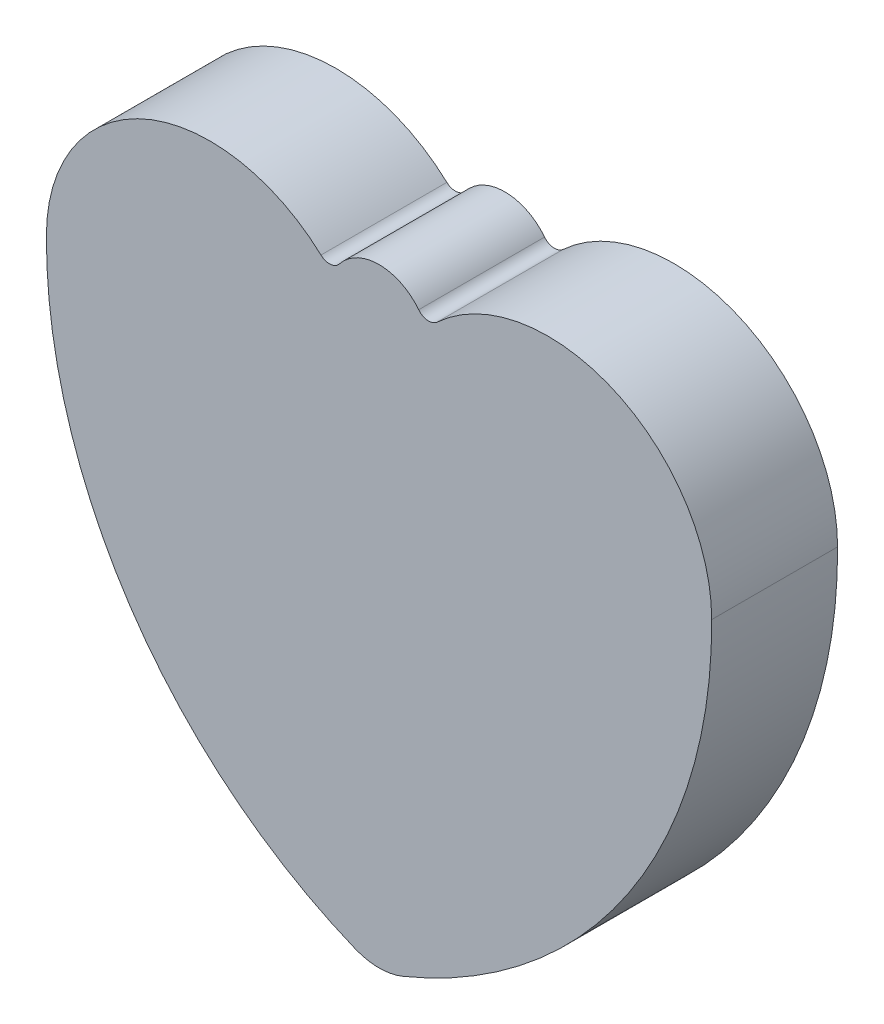
from build123d import *

# Parameters (mm, degrees)
DODANIE_WYCI_GNI_CIE1_DEPTH = 10
SKALA1_SCALE                = 0.85


with BuildPart() as part:
    # Szkic1 → Dodanie-wyciągnięcie1 (new body)
    with BuildSketch(Plane.XY):
        with BuildLine():
            ThreePointArc((-4.61531313, 22.743178996), (-18.644238864, 25.090860352), (-26.425868288, 13.184197993))
            ThreePointArc((-26.425868288, 13.184197993), (-19.794080105, -8.974802604), (-1.896314698, -23.62648904))
            ThreePointArc((-1.896314698, -23.62648904), (0, -24.000044339), (1.896314698, -23.62648904))
            ThreePointArc((1.896314698, -23.62648904), (19.794080105, -8.974802604), (26.425868288, 13.184197993))
            ThreePointArc((26.425868288, 13.184197993), (18.644238864, 25.090860352), (4.61531313, 22.743178996))
            ThreePointArc((4.61531313, 22.743178996), (3.856622065, 22.481767555), (3.150062494, 22.862190539))
            ThreePointArc((3.150062494, 22.862190539), (0, 24.397011786), (-3.150062494, 22.862190539))
            ThreePointArc((-3.150062494, 22.862190539), (-3.856622065, 22.481767555), (-4.61531313, 22.743178996))
        make_face()
    extrude(amount=DODANIE_WYCI_GNI_CIE1_DEPTH)


with BuildPart() as part_1:
    # Skala1: scaled about (0, 3.998335482, 5)
    add(part.part.scale(SKALA1_SCALE).moved(Location((0, 0.599750322, 0.75))))


solid = part_1.part
